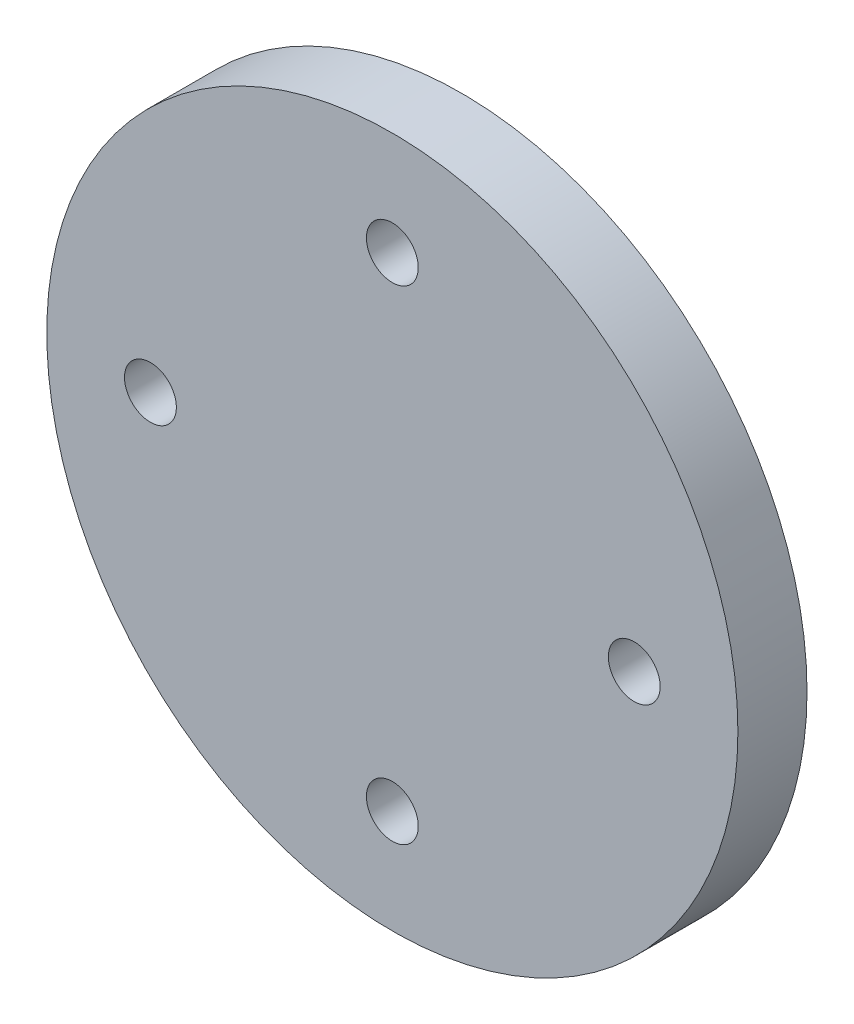
from build123d import *

# Parameters (mm, degrees)
SKETCH_1_R          = 10
EXTRUDE_1_DEPTH     = 2
SKETCH_2_R          = 4
EXTRUDE_2_DEPTH     = 2
SKETCH_3_R          = 3.05
CUT_EXTRUDE_1_DEPTH = 3.5
SKETCH_4_R          = 0.75
CUT_EXTRUDE_2_DEPTH = 15.282856857


with BuildPart() as part:
    # 草图1 → 凸台-拉伸1 (new body)
    with BuildSketch(Plane.XY):
        Circle(SKETCH_1_R)
    extrude(amount=EXTRUDE_1_DEPTH)

    # 草图2 → 凸台-拉伸2 (add)
    with BuildSketch(Plane(origin=(0, 0, 0), x_dir=(-1, 0, 0), z_dir=(0, 0, -1))):
        Circle(SKETCH_2_R)
    extrude(amount=EXTRUDE_2_DEPTH)

    # 草图3 → 切除-拉伸1 (cut)
    with BuildSketch(Plane(origin=(0, 0, -2), x_dir=(-1, 0, 0), z_dir=(0, 0, -1))):
        Circle(SKETCH_3_R)
    extrude(amount=-CUT_EXTRUDE_1_DEPTH, mode=Mode.SUBTRACT)

    # 草图4 → 切除-拉伸2 (cut, through all)
    with BuildSketch(Plane(origin=(0, 0, 0), x_dir=(-1, 0, 0), z_dir=(0, 0, -1))):
        with Locations((0, 7)):
            Circle(SKETCH_4_R)
        with Locations((7, 0)):
            Circle(SKETCH_4_R)
        with Locations((0, -7)):
            Circle(SKETCH_4_R)
        with Locations((-7, 0)):
            Circle(SKETCH_4_R)
    extrude(amount=-CUT_EXTRUDE_2_DEPTH, mode=Mode.SUBTRACT)


solid = part.part
